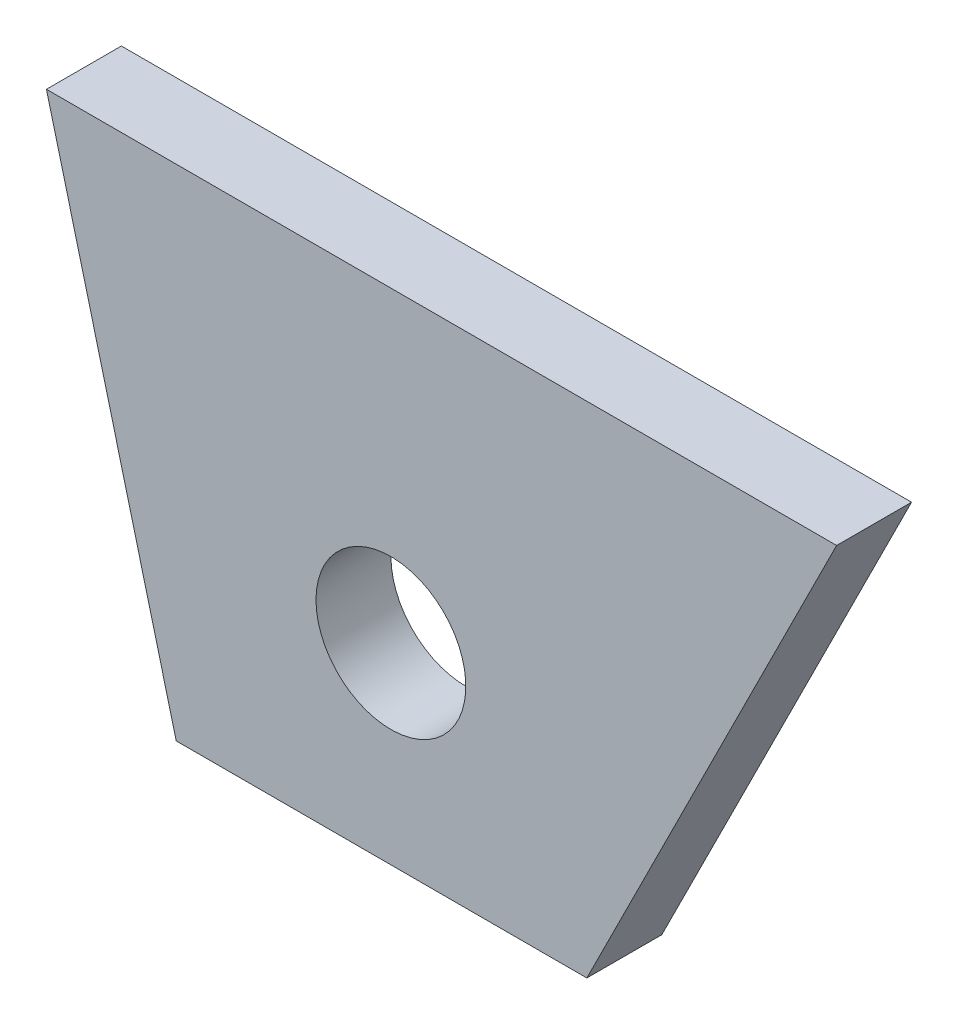
from build123d import *

# Parameters (mm, degrees)
SKETCH2_R           = 76.2
BOSS_EXTRUDE2_DEPTH = 76.2


with BuildPart() as part:
    # Sketch2 → Boss-Extrude2 (new body)
    with BuildSketch(Plane.XY):
        Polygon((0, 0), (803.656, 0), (549.615688221, -508), (131.991038362, -508), align=None)
        with Locations(Location((350.334210966, -312.584818641, 0), (0, 0, 180))):
            Circle(SKETCH2_R, mode=Mode.SUBTRACT)
    extrude(amount=BOSS_EXTRUDE2_DEPTH)


solid = part.part
